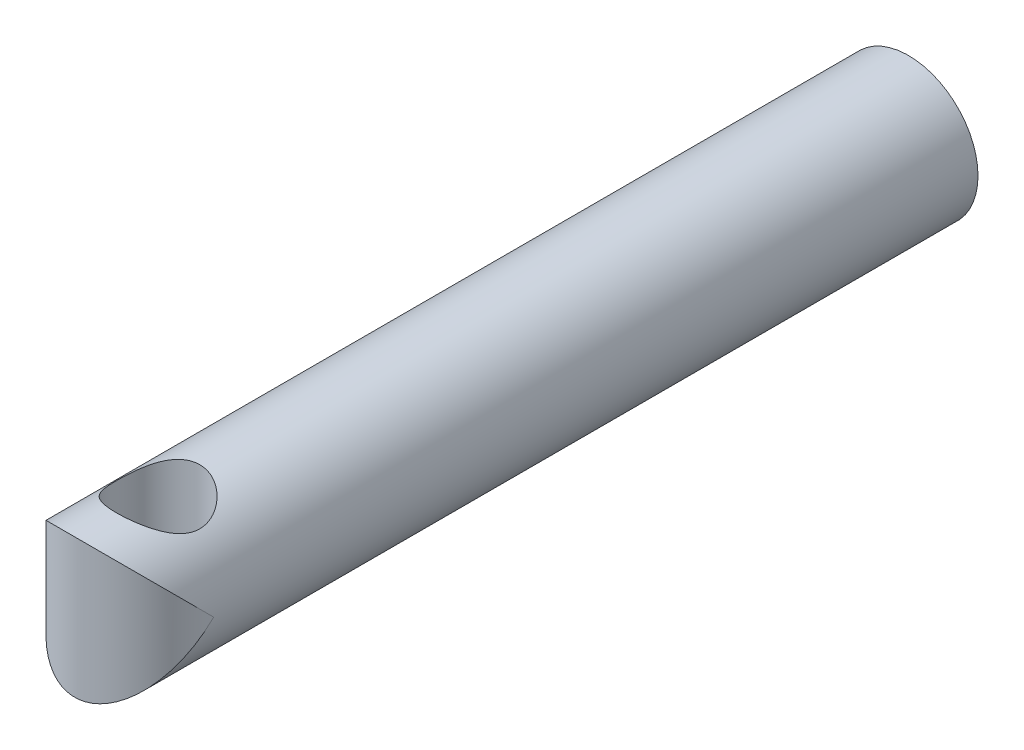
from build123d import *

# Parameters (mm, degrees)
SKETCH1_R               = 2.5
BOSS_EXTRUDE1_DEPTH     = 30
CUT_EXTRUDE1_DEPTH      = 31.207614934
CUT_EXTRUDE1_DEPTH_BACK = 31.207614934
SKETCH2_R               = 1.5


with BuildPart() as part:
    # Sketch1 → Boss-Extrude1 (new body)
    with BuildSketch(Plane.XY):
        Circle(SKETCH1_R)
    extrude(amount=BOSS_EXTRUDE1_DEPTH)

    # Sketch2 → Cut-Extrude1 (cut, two sides: drawn at the far end of the back side and taken through both)
    with BuildSketch(Plane(origin=(0, 0, 0), x_dir=(1, 0, 0), z_dir=(0, 1, 0)).offset(-CUT_EXTRUDE1_DEPTH_BACK)):
        with Locations(Location((0, -27, 0), (0, 0, 270))):
            Circle(SKETCH2_R)
        with BuildLine():
            ThreePointArc((0, -30), (-1.767766953, -29.267766953), (-2.5, -27.5))
            Line((-2.5, -27.5), (-2.5, -30))
            Line((-2.5, -30), (0, -30))
        make_face()
        with BuildLine():
            Line((2.5, -30), (2.5, -27.5))
            ThreePointArc((2.5, -27.5), (1.767766953, -29.267766953), (0, -30))
            Line((0, -30), (2.5, -30))
        make_face()
    extrude(amount=CUT_EXTRUDE1_DEPTH + CUT_EXTRUDE1_DEPTH_BACK, mode=Mode.SUBTRACT)


solid = part.part
